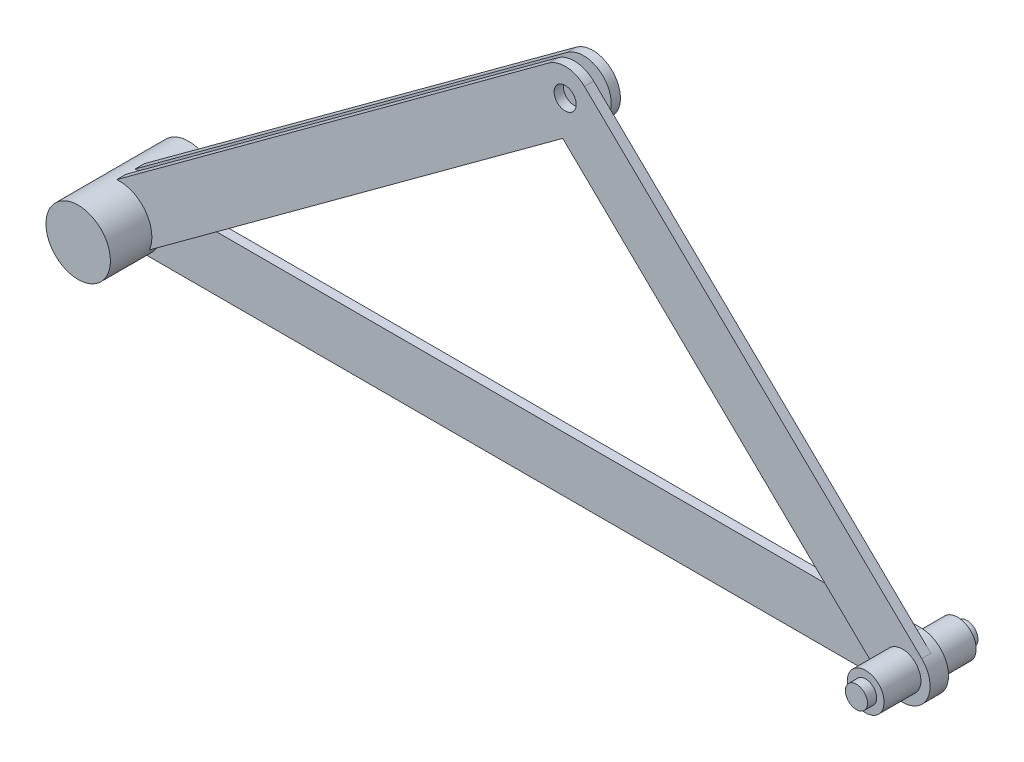
from build123d import *

# Parameters (mm, degrees)
SKETCH_1_W      = 450
SKETCH_1_H      = 30
EXTRUDE_1_DEPTH = 5
FILLET_1_RADIUS = 15
FILLET_1_LENGTH = 5
FILLET_2_RADIUS = 15
FILLET_2_LENGTH = 5
SKETCH_2_R      = 10
SKETCH_2_R_2    = 6
EXTRUDE_2_DEPTH = 17.5
SKETCH_4_R      = 6
EXTRUDE_3_DEPTH = 5
SKETCH_5_R      = 6
EXTRUDE_4_DEPTH = 5
EXTRUDE_START   = 7.5
SKETCH_6_R      = 10
EXTRUDE_5_DEPTH = 7.5
SKETCH_7_R      = 6
EXTRUDE_6_DEPTH = 5
SKETCH_8_R      = 17.5
EXTRUDE_7_DEPTH = 30


with BuildPart() as part:
    # 草图1 → 凸台-拉伸1 (new body)
    with BuildSketch(Plane.XY):
        Rectangle(SKETCH_1_W, SKETCH_1_H)
    extrude(amount=EXTRUDE_1_DEPTH)

    # 圆角1: full round fillet: the end face becomes a half cylinder, R = half its width
    fillet_1_face = Plane((-225, 0, 2.5), x_dir=(0, 0, 1), z_dir=(-1, 0, 0))  # on the end face: x along it, z out of the body
    fillet_1_slab = fillet_1_face.offset(-FILLET_1_RADIUS / 2) * Box(FILLET_1_LENGTH, 2 * FILLET_1_RADIUS, FILLET_1_RADIUS, mode=Mode.PRIVATE)  # the body's end, R deep
    fillet_1_round = Plane((-210, 0, 2.5), x_dir=(-1, 0, 0), z_dir=(0, 0, 1)) * Cylinder(FILLET_1_RADIUS, FILLET_1_LENGTH, mode=Mode.PRIVATE)  # its axis R under the face
    add(fillet_1_slab - fillet_1_round, mode=Mode.SUBTRACT)

    # 圆角2: full round fillet: the end face becomes a half cylinder, R = half its width
    fillet_2_face = Plane((225, 0, 2.5), x_dir=(0, 0, -1), z_dir=(1, 0, 0))  # on the end face: x along it, z out of the body
    fillet_2_slab = fillet_2_face.offset(-FILLET_2_RADIUS / 2) * Box(FILLET_2_LENGTH, 2 * FILLET_2_RADIUS, FILLET_2_RADIUS, mode=Mode.PRIVATE)  # the body's end, R deep
    fillet_2_round = Plane((210, 0, 2.5), x_dir=(1, 0, 0), z_dir=(0, 0, -1)) * Cylinder(FILLET_2_RADIUS, FILLET_2_LENGTH, mode=Mode.PRIVATE)  # its axis R under the face
    add(fillet_2_slab - fillet_2_round, mode=Mode.SUBTRACT)

    # 草图2 → 凸台-拉伸2 (add, symmetric)
    # profile 1 of 2: a face of its own
    with BuildSketch(Plane.XY.offset(5)):
        with Locations(Location((-215, 0, 0), (0, 0, 180.000443811))):
            Circle(SKETCH_2_R)
        with Locations((-215, 0)):
            Circle(SKETCH_2_R_2, mode=Mode.SUBTRACT)
    # profile 2 of 2: a face of its own
    with BuildSketch(Plane.XY.offset(5)):
        with Locations((210, 0)):
            Circle(SKETCH_2_R)
        with Locations((210, 0)):
            Circle(SKETCH_2_R_2, mode=Mode.SUBTRACT)
    extrude(amount=EXTRUDE_2_DEPTH, both=True)

    # 草图4 → 凸台-拉伸3 (add)
    with BuildSketch(Plane.XY.offset(5)):
        with BuildLine():
            Line((199.561031329, -10.771626298), (16.443384271, 166.690841102))
            ThreePointArc((16.443384271, 166.690841102), (16.110726644, 187.90143607), (37.321321612, 188.234093697))
            Line((37.321321612, 188.234093697), (220.438968671, 10.771626298))
            ThreePointArc((220.438968671, 10.771626298), (220.771626298, -10.438968671), (199.561031329, -10.771626298))
        make_face()
        with Locations((26.882352941, 177.4624674)):
            Circle(SKETCH_4_R, mode=Mode.SUBTRACT)
    extrude(amount=EXTRUDE_3_DEPTH)

    # 草图5 → 凸台-拉伸4 (add)
    with BuildSketch(Plane.XY.offset(5)):
        with BuildLine():
            Line((-223.87312337, 12.094117647), (18.009229571, 189.556585047))
            ThreePointArc((18.009229571, 189.556585047), (38.976470588, 186.33559077), (35.755476311, 165.368349753))
            Line((35.755476311, 165.368349753), (-206.12687663, -12.094117647))
            ThreePointArc((-206.12687663, -12.094117647), (-227.094117647, -8.87312337), (-223.87312337, 12.094117647))
        make_face()
        with Locations((26.882352941, 177.4624674)):
            Circle(SKETCH_5_R, mode=Mode.SUBTRACT)
    extrude_4 = extrude(amount=EXTRUDE_4_DEPTH)

    # 镜向1: 凸台-拉伸4 across plane
    add(extrude_4.mirror(Plane.XY.offset(2.5)))

    # 草图6 → 凸台-拉伸5 (add)
    with BuildSketch(Plane.XY.offset(22.5).offset(EXTRUDE_START)):
        with Locations((210, 0)):
            Circle(SKETCH_6_R)
    extrude_5 = extrude(amount=-EXTRUDE_5_DEPTH)

    # 草图7 → 凸台-拉伸6 (add)
    with BuildSketch(Plane.XY.offset(30)):
        with Locations((210, 0)):
            Circle(SKETCH_7_R)
    extrude_6 = extrude(amount=EXTRUDE_6_DEPTH)

    # 镜向2: 凸台-拉伸5, 凸台-拉伸6 across plane
    add(extrude_5.mirror(Plane.XY.offset(5)))
    add(extrude_6.mirror(Plane.XY.offset(5)))

    # 草图8 → 凸台-拉伸7 (add, symmetric)
    with BuildSketch(Plane.XY.offset(2.5)):
        with Locations((-215, 0)):
            Circle(SKETCH_8_R)
    extrude(amount=EXTRUDE_7_DEPTH, both=True)


solid = part.part
